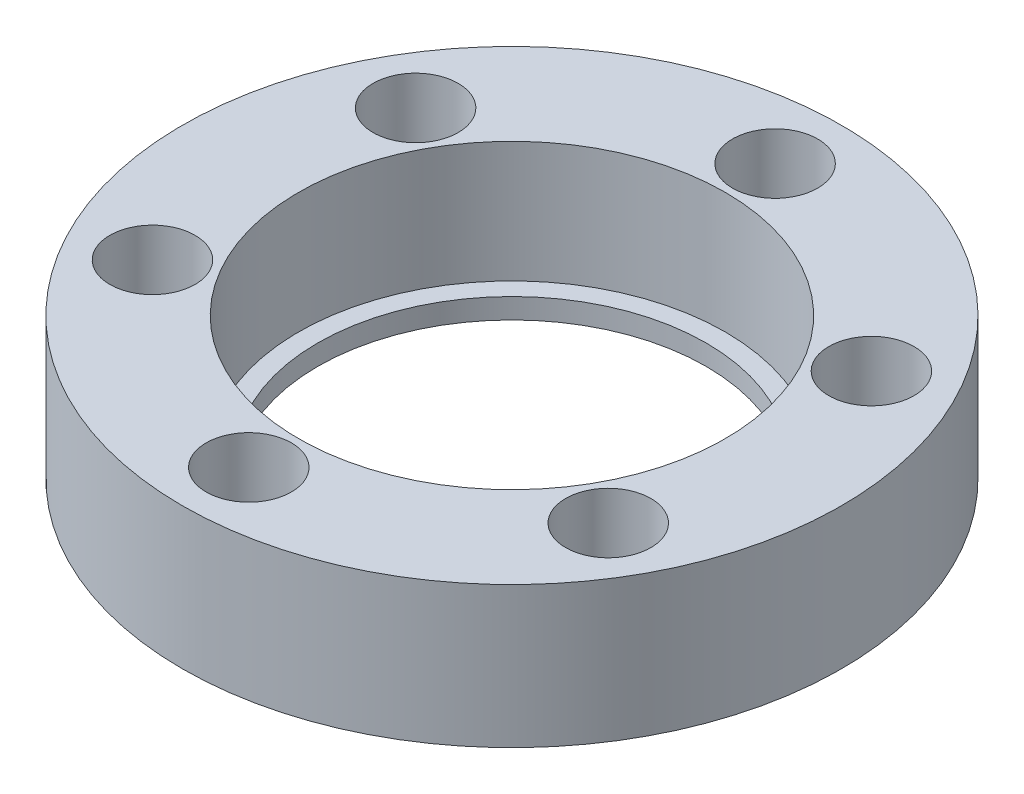
from build123d import *

# Parameters (mm, degrees)
SKETCH1_R         = 16.891
EXTRUDE1_DEPTH    = 7.239
SKETCH2_R         = 10.9347
EXTRUDE2_DEPTH    = 25.960266084
SKETCH3_R         = 10.9347
SKETCH3_R_2       = 9.9568
EXTRUDE3_DEPTH    = 1.0414
SKETCH4_R         = 2.1844
EXTRUDE4_DEPTH    = 25.960266084
CIRPATTERN1_COUNT = 6


with BuildPart() as part:
    # Sketch1 → Extrude1 (new body)
    with BuildSketch(Plane(origin=(0, 0, 0), x_dir=(1, 0, 0), z_dir=(0, 1, 0))):
        with Locations(Location((0, 0, 0), (0, 0, 270))):
            Circle(SKETCH1_R)
    extrude(amount=EXTRUDE1_DEPTH)

    # Sketch2 → Extrude2 (cut, through all)
    with BuildSketch(Plane.XZ):
        with Locations(Location((0, 0, 0), (0, 0, 270))):
            Circle(SKETCH2_R)
    extrude(amount=-EXTRUDE2_DEPTH, mode=Mode.SUBTRACT)

    # Sketch3 → Extrude3 (add)
    with BuildSketch(Plane.XZ):
        with Locations(Location((0, 0, 0), (0, 0, 270))):
            Circle(SKETCH3_R)
        with Locations(Location((0, 0, 0), (0, 0, 270))):
            Circle(SKETCH3_R_2, mode=Mode.SUBTRACT)
    extrude(amount=-EXTRUDE3_DEPTH)

    # Sketch4 → Extrude4 (cut, through all)
    with BuildSketch(Plane(origin=(0, 7.239, 0), x_dir=(1, 0, 0), z_dir=(0, 1, 0))):
        with Locations(Location((0, 13.4874, 0), (0, 0, 270))):
            Circle(SKETCH4_R)
    extrude4 = extrude(amount=-EXTRUDE4_DEPTH, mode=Mode.SUBTRACT)

    # CirPattern1: Extrude4 ×6 about axis
    cirpattern1_axis = Axis((0, 0, 0), (0, 1, 0))
    for i in range(1, CIRPATTERN1_COUNT):
        add(extrude4.rotate(cirpattern1_axis, i * 360 / CIRPATTERN1_COUNT), mode=Mode.SUBTRACT)


solid = part.part
